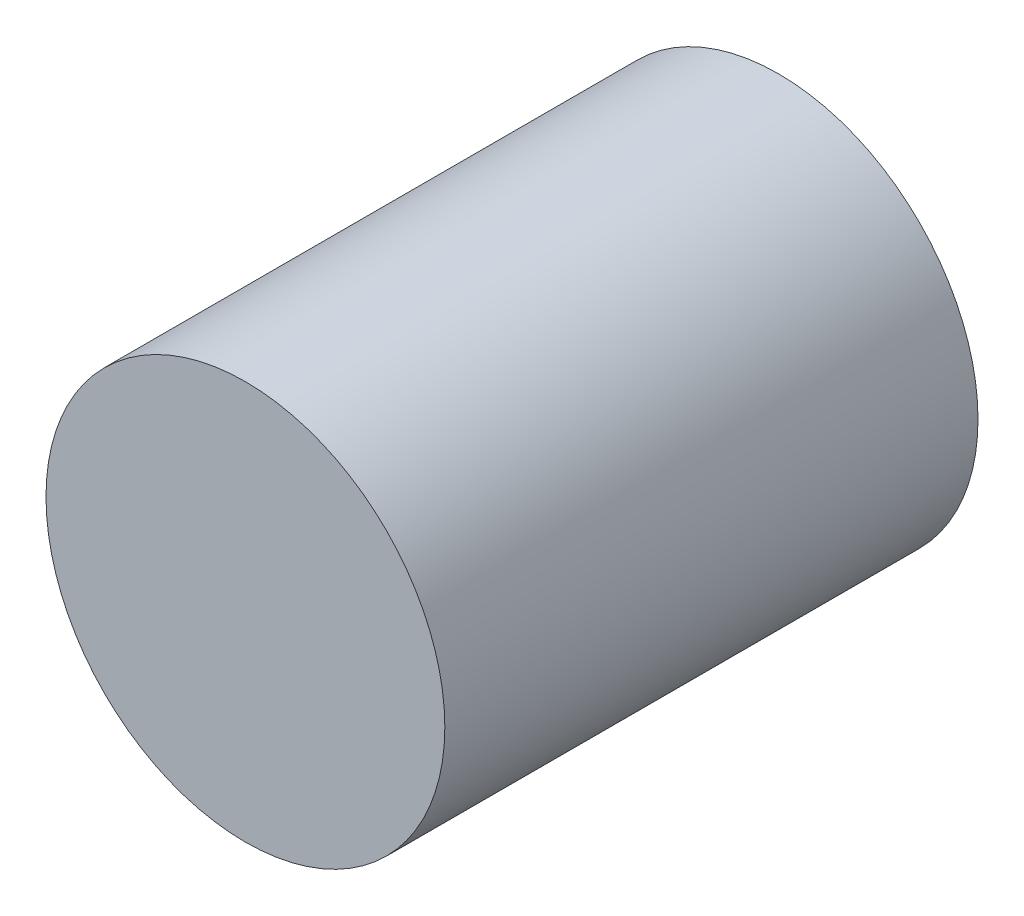
from build123d import *

# Parameters (mm, degrees)
SKETCH1_R          = 4.75
BASE_EXTRUDE_DEPTH = 12.7


with BuildPart() as part:
    # Sketch1 → Base-Extrude (new body)
    with BuildSketch(Plane.XY):
        Circle(SKETCH1_R)
    extrude(amount=BASE_EXTRUDE_DEPTH)


solid = part.part
